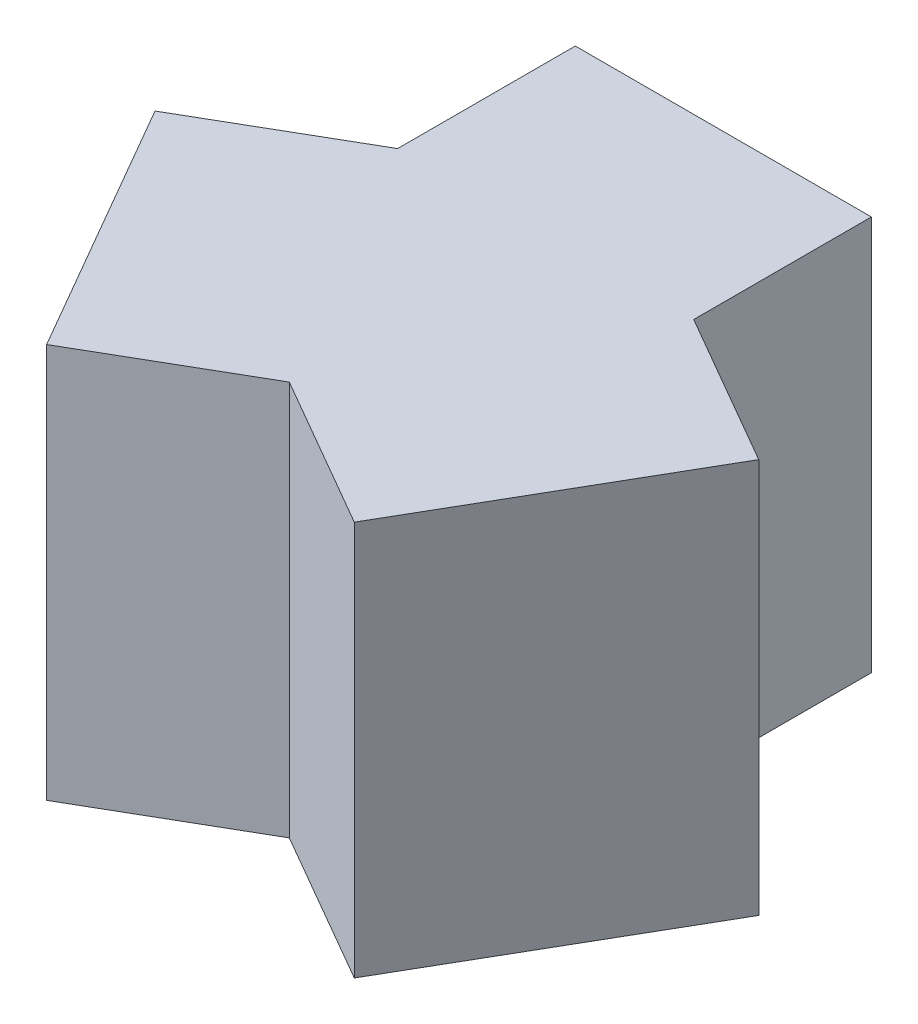
from build123d import *

# Parameters (mm, degrees)
BOSS_EXTRUDE1_DEPTH = 10


with BuildPart() as part:
    # Sketch1 → Boss-Extrude1 (new, symmetric)
    with BuildSketch(Plane(origin=(0, 0, 0), x_dir=(1, 0, 0), z_dir=(0, 1, 0))):
        Polygon((15.294228634, 0.5), (7.5, 5), (7.5, 14), (-7.5, 14), (-7.5, 5), (-15.294228634, 0.5), (-7.794228634, -12.490381057), (0, -7.990381057), (7.794228634, -12.490381057), align=None)
    extrude(amount=BOSS_EXTRUDE1_DEPTH, both=True)


solid = part.part
